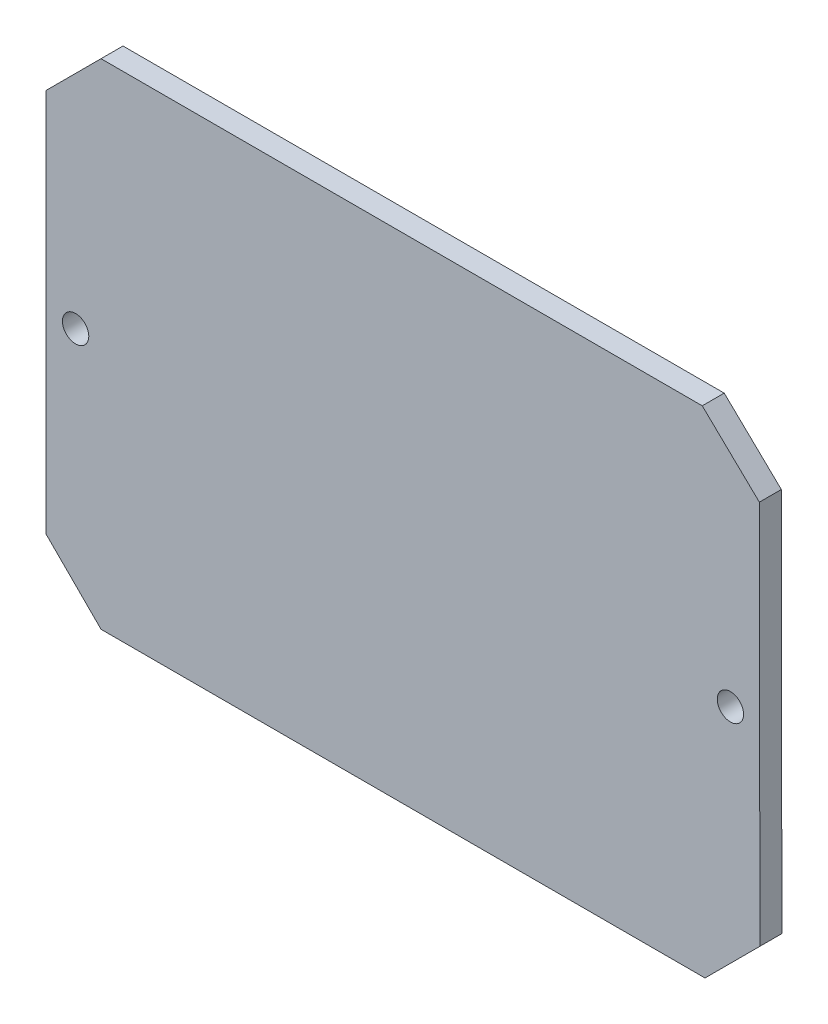
from build123d import *

# Parameters (mm, degrees)
SKETCH1_R      = 3.81
EXTRUDE1_DEPTH = 6.35


with BuildPart() as part:
    # Sketch1 → Extrude1 (new body)
    with BuildSketch(Plane.XY):
        Polygon((153.8306681, 29.27590686), (153.9882813, -81.852219443), (138.1132813, -97.727219443), (-36.5117187, -97.727219443), (-52.3867187, -81.852219443), (-52.3867187, 29.272780557), (-36.5117187, 45.147780557), (137.315954212, 45.147780557), align=None)
        with Locations((145.461332338, -26.140965423)):
            Circle(SKETCH1_R, mode=Mode.SUBTRACT)
        with Locations((-43.861393994, -26.140965423)):
            Circle(SKETCH1_R, mode=Mode.SUBTRACT)
    extrude(amount=EXTRUDE1_DEPTH)


solid = part.part
